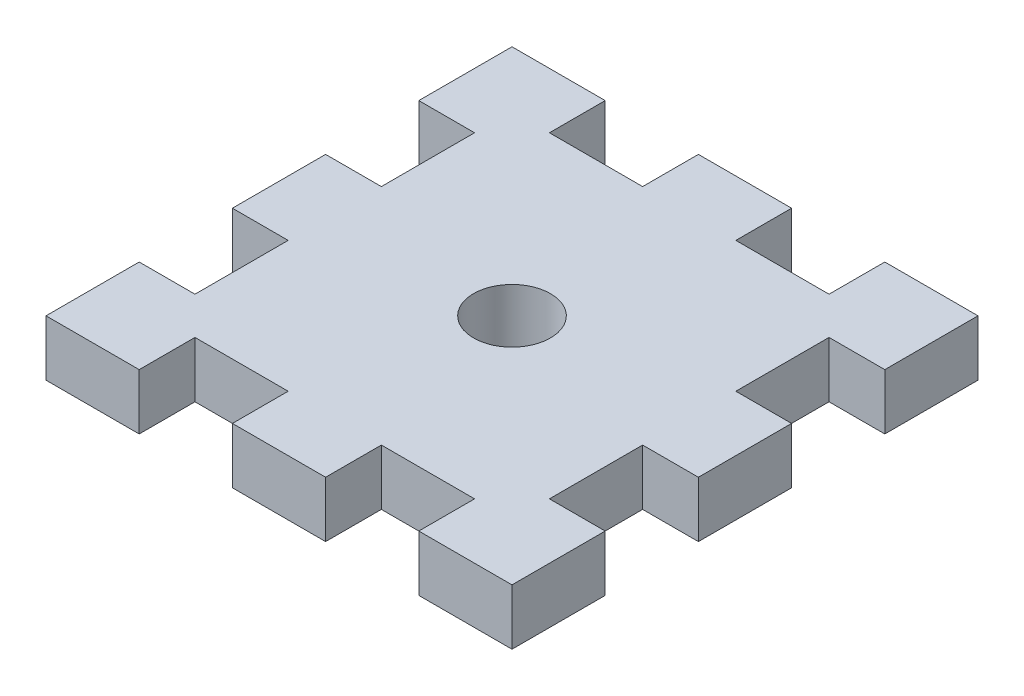
from build123d import *

# Parameters (mm, degrees)
SKETCH1_R           = 3.14325
BOSS_EXTRUDE1_DEPTH = 4.5593


with BuildPart() as part:
    # Sketch1 → Boss-Extrude1 (new body)
    with BuildSketch(Plane(origin=(0, 0, 0), x_dir=(1, 0, 0), z_dir=(0, 1, 0))):
        Polygon((-11.43, 19.05), (-19.05, 19.05), (-19.05, 11.43), (-14.4907, 11.43), (-14.4907, 3.81), (-19.05, 3.81), (-19.05, -3.81), (-14.4907, -3.81), (-14.4907, -11.43), (-19.05, -11.43), (-19.05, -19.05), (-11.43, -19.05), (-11.43, -14.4907), (-3.81, -14.4907), (-3.81, -19.05), (3.81, -19.05), (3.81, -14.4907), (11.43, -14.4907), (11.43, -19.05), (19.05, -19.05), (19.05, -11.43), (14.4907, -11.43), (14.4907, -3.81), (19.05, -3.81), (19.05, 3.81), (14.4907, 3.81), (14.4907, 11.43), (19.05, 11.43), (19.05, 19.05), (11.43, 19.05), (11.43, 14.4907), (3.81, 14.4907), (3.81, 19.05), (-3.81, 19.05), (-3.81, 14.4907), (-11.43, 14.4907), align=None)
        with Locations(Location((0, 0, 0), (0, 0, 90))):
            Circle(SKETCH1_R, mode=Mode.SUBTRACT)
    extrude(amount=BOSS_EXTRUDE1_DEPTH)


solid = part.part
